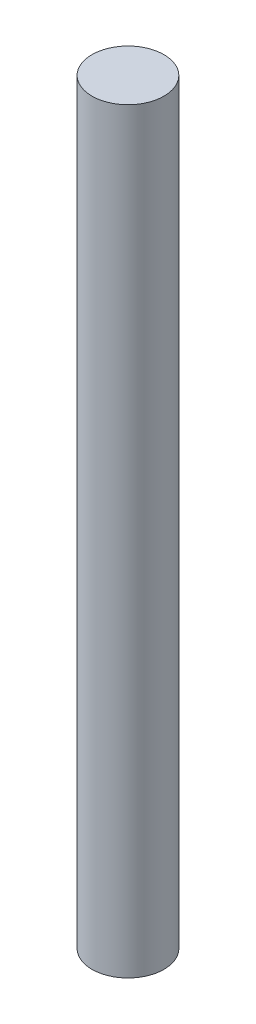
from build123d import *

# Parameters (mm, degrees)
SKETCH1_R           = 1
BOSS_EXTRUDE1_DEPTH = 21.02


with BuildPart() as part:
    # Sketch1 → Boss-Extrude1 (new body)
    with BuildSketch(Plane(origin=(0, 0, 0), x_dir=(1, 0, 0), z_dir=(0, 1, 0))):
        with Locations(Location((0, 0, 0), (0, 0, 270))):
            Circle(SKETCH1_R)
    extrude(amount=BOSS_EXTRUDE1_DEPTH)


solid = part.part
